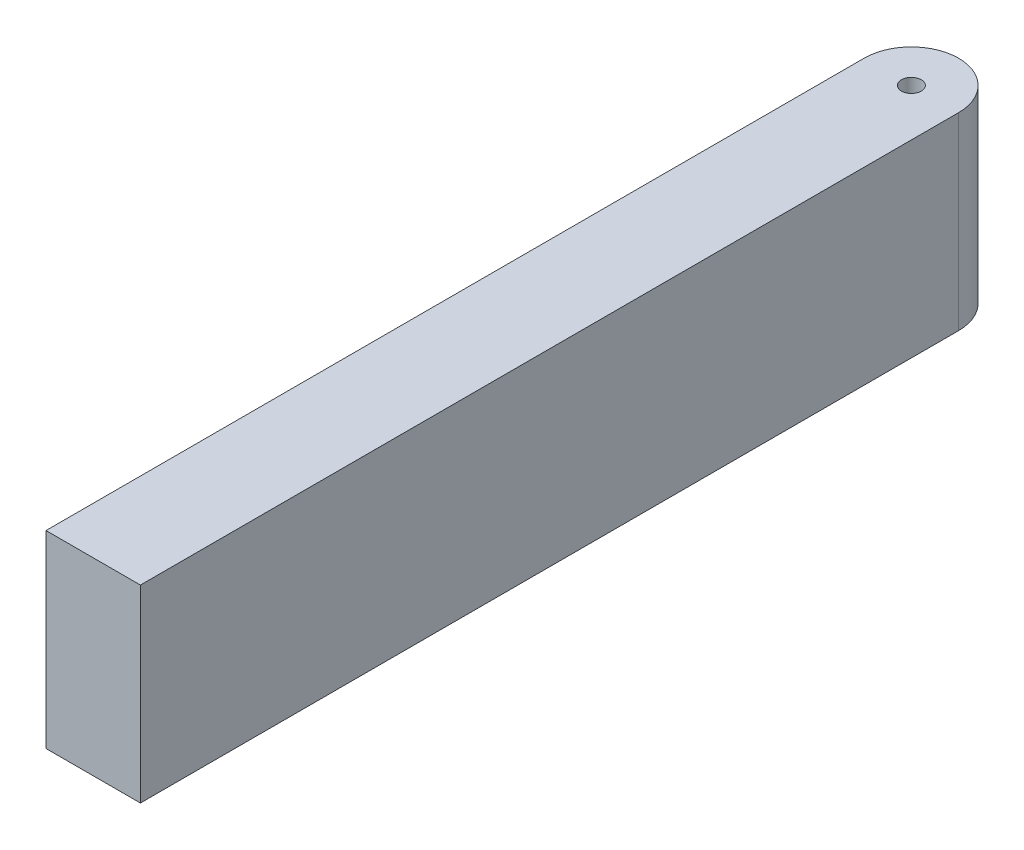
from build123d import *

# Parameters (mm, degrees)
SKETCH1_W           = 19.05
SKETCH1_H           = 76.2
REVOLVE1_ANGLE      = 180
SKETCH2_W           = 38.1
SKETCH2_H           = 76.2
BOSS_EXTRUDE1_DEPTH = 330.2
SKETCH3_R           = 3.9878
CUT_EXTRUDE1_DEPTH  = 342.013328185


with BuildPart() as part:
    # Sketch1 → Revolve1 (revolve)
    with BuildSketch(Plane.XY):
        with Locations((9.525, -38.1)):
            Rectangle(SKETCH1_W, SKETCH1_H)
    revolve(axis=Axis((19.05, 0, 0), (0, -1, 0)), revolution_arc=REVOLVE1_ANGLE)

    # Sketch2 → Boss-Extrude1 (add)
    with BuildSketch(Plane.XY):
        with Locations((19.05, -38.1)):
            Rectangle(SKETCH2_W, SKETCH2_H)
    extrude(amount=BOSS_EXTRUDE1_DEPTH)

    # Sketch3 → Cut-Extrude1 (cut, through all)
    with BuildSketch(Plane(origin=(0, 0, 0), x_dir=(1, 0, 0), z_dir=(0, 1, 0))):
        with Locations(Location((19.05, 0, 0), (0, 0, 180))):
            Circle(SKETCH3_R)
    extrude(amount=-CUT_EXTRUDE1_DEPTH, mode=Mode.SUBTRACT)


solid = part.part
